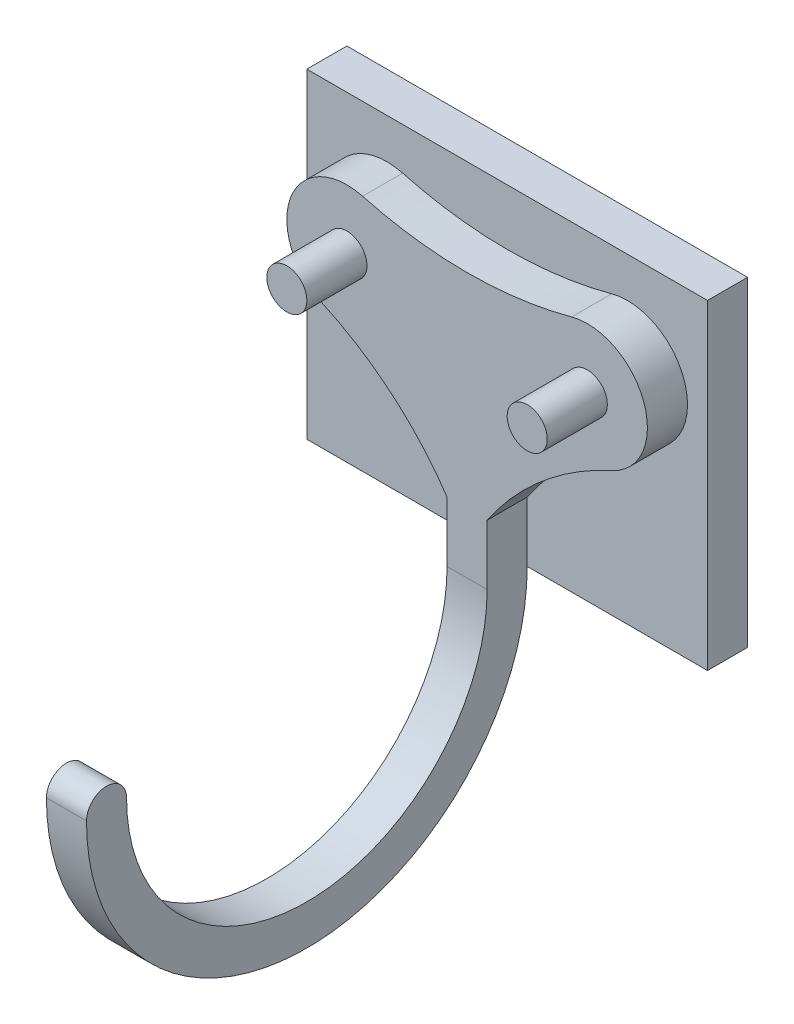
from build123d import *

# Parameters (mm, degrees)
BOSS_EXTRUDE2_DEPTH = 2
SKETCH1_5_R         = 1
BOSS_EXTRUDE3_DEPTH = 4
SKETCH1_6_R         = 1
BOSS_EXTRUDE4_DEPTH = 7
SKETCH2_W           = 2
SKETCH2_H           = 2
REVOLVE1_ANGLE      = 180
SKETCH3_R           = 1
BOSS_EXTRUDE5_DEPTH = 2


with BuildPart() as part:
    # Sketch1 → Boss-Extrude2 (new body)
    with BuildSketch(Plane.XY):
        with BuildLine():
            Line((-10, 8), (-10, -8))
            Line((-10, -8), (-1, -8))
            Line((-1, -8), (-1, -5))
            ThreePointArc((-1, -5), (-3.753951843, -1.933561128), (-7.238522191, 0.267590297))
            ThreePointArc((-7.238522191, 0.267590297), (-8.82348314, 4.013875218), (-5.217391304, 5.896122171))
            ThreePointArc((-5.217391304, 5.896122171), (0, 5.203603311), (5.217391304, 5.896122171))
            ThreePointArc((5.217391304, 5.896122171), (8.82348314, 4.013875218), (7.238522191, 0.267590297))
            ThreePointArc((7.238522191, 0.267590297), (3.753951843, -1.933561128), (1, -5))
            Line((1, -5), (1, -8))
            Line((1, -8), (10, -8))
            Line((10, -8), (10, 8))
            Line((10, 8), (-10, 8))
        make_face()
    extrude(amount=BOSS_EXTRUDE2_DEPTH)

    # Sketch1<5> → Boss-Extrude3 (add)
    with BuildSketch(Plane.XY):
        with BuildLine():
            Line((-1, -5), (-1, -8))
            Line((-1, -8), (1, -8))
            Line((1, -8), (1, -5))
            ThreePointArc((1, -5), (3.753951843, -1.933561128), (7.238522191, 0.267590297))
            ThreePointArc((7.238522191, 0.267590297), (8.82348314, 4.013875218), (5.217391304, 5.896122171))
            ThreePointArc((5.217391304, 5.896122171), (0, 5.203603311), (-5.217391304, 5.896122171))
            ThreePointArc((-5.217391304, 5.896122171), (-8.82348314, 4.013875218), (-7.238522191, 0.267590297))
            ThreePointArc((-7.238522191, 0.267590297), (-3.753951843, -1.933561128), (-1, -5))
        make_face()
        with Locations((-6, 3)):
            Circle(SKETCH1_5_R, mode=Mode.SUBTRACT)
        with Locations((6, 3)):
            Circle(SKETCH1_5_R, mode=Mode.SUBTRACT)
    extrude(amount=BOSS_EXTRUDE3_DEPTH)

    # Sketch1<6> → Boss-Extrude4 (add)
    with BuildSketch(Plane.XY):
        with Locations((6, 3)):
            Circle(SKETCH1_6_R)
        with Locations((-6, 3)):
            Circle(SKETCH1_6_R)
    extrude(amount=BOSS_EXTRUDE4_DEPTH)

    # Sketch2 → Revolve1 (revolve)
    with BuildSketch(Plane.XZ.offset(8)):
        with Locations((0, 3)):
            Rectangle(SKETCH2_W, SKETCH2_H)
    revolve(axis=Axis((-9.9, -8, 13), (-1, 0, 0)), revolution_arc=REVOLVE1_ANGLE)

    # Sketch3 → Boss-Extrude5 (add)
    with BuildSketch(Plane.ZY.offset(1)):
        with Locations((23, -8)):
            Circle(SKETCH3_R)
    extrude(amount=-BOSS_EXTRUDE5_DEPTH)


solid = part.part
